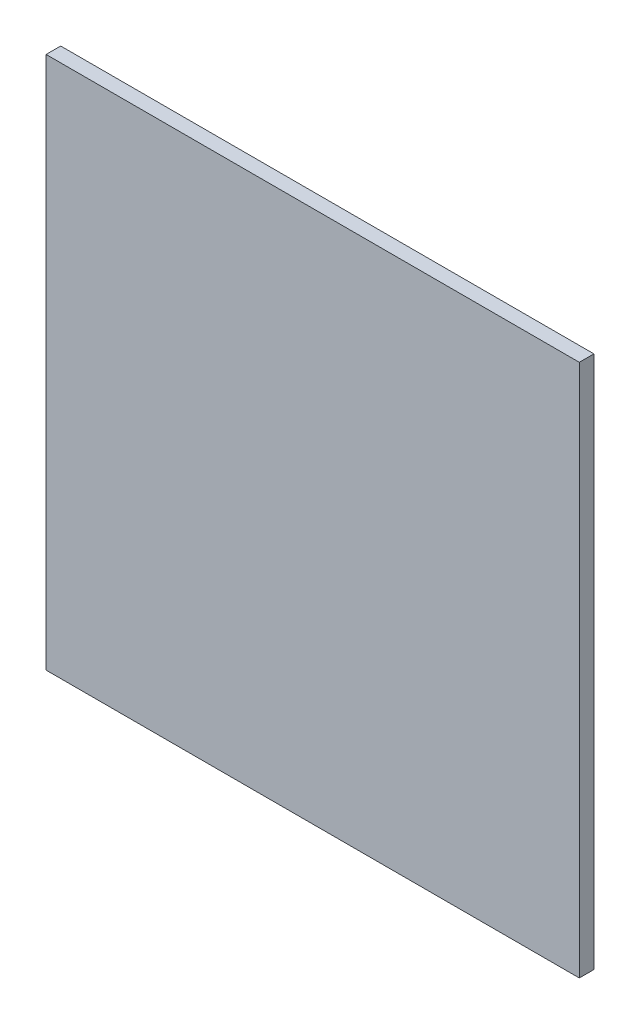
from build123d import *

# Parameters (mm, degrees)
SKETCH1_W           = 73
SKETCH1_H           = 73
BOSS_EXTRUDE1_DEPTH = 2


with BuildPart() as part:
    # Sketch1 → Boss-Extrude1 (new body)
    with BuildSketch(Plane.XY):
        Rectangle(SKETCH1_W, SKETCH1_H)
    extrude(amount=BOSS_EXTRUDE1_DEPTH)


solid = part.part
